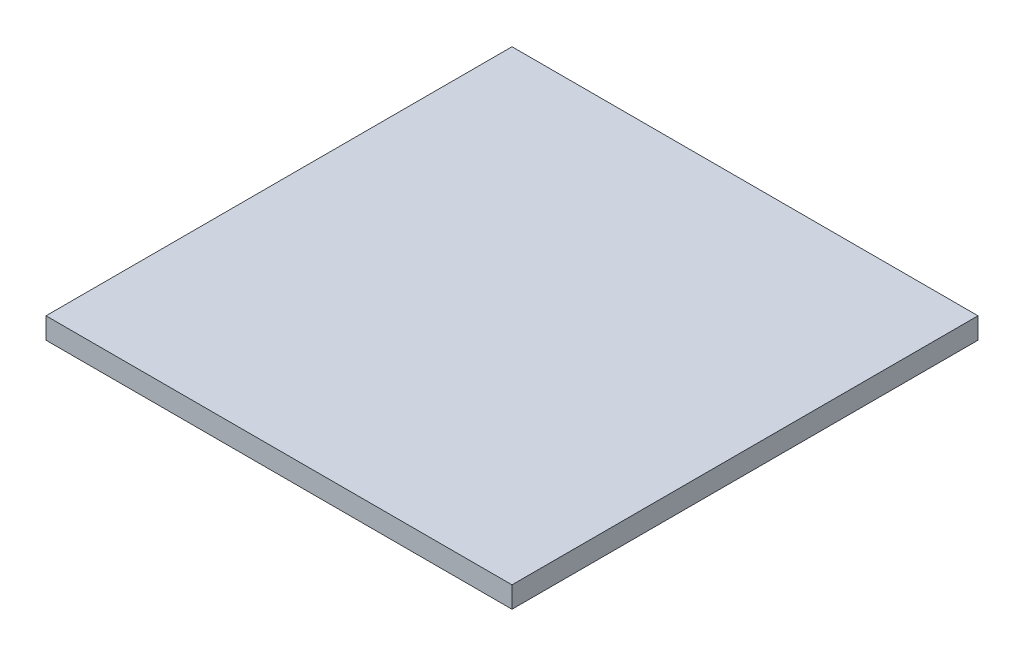
from build123d import *

# Parameters (mm, degrees)
ESBO_O1_W                = 55
ESBO_O1_H                = 55
RESSALTO_EXTRUS_O1_DEPTH = 2
ESBO_O3_W                = 55
ESBO_O3_H                = 55
ESBO_O3_R                = 25
RESSALTO_EXTRUS_O3_DEPTH = 0.5


with BuildPart() as part:
    # Esboço1 → Ressalto-extrusão1 (new body)
    with BuildSketch(Plane(origin=(0, 0, 0), x_dir=(1, 0, 0), z_dir=(0, 1, 0))):
        Rectangle(ESBO_O1_W, ESBO_O1_H)
    extrude(amount=RESSALTO_EXTRUS_O1_DEPTH)

    # Esboço3 → Ressalto-extrusão3 (add)
    with BuildSketch(Plane.XZ):
        Rectangle(ESBO_O3_W, ESBO_O3_H)
        with Locations(Location((0, 0, 0), (0, 0, 270))):
            Circle(ESBO_O3_R, mode=Mode.SUBTRACT)
    extrude(amount=RESSALTO_EXTRUS_O3_DEPTH)


solid = part.part
